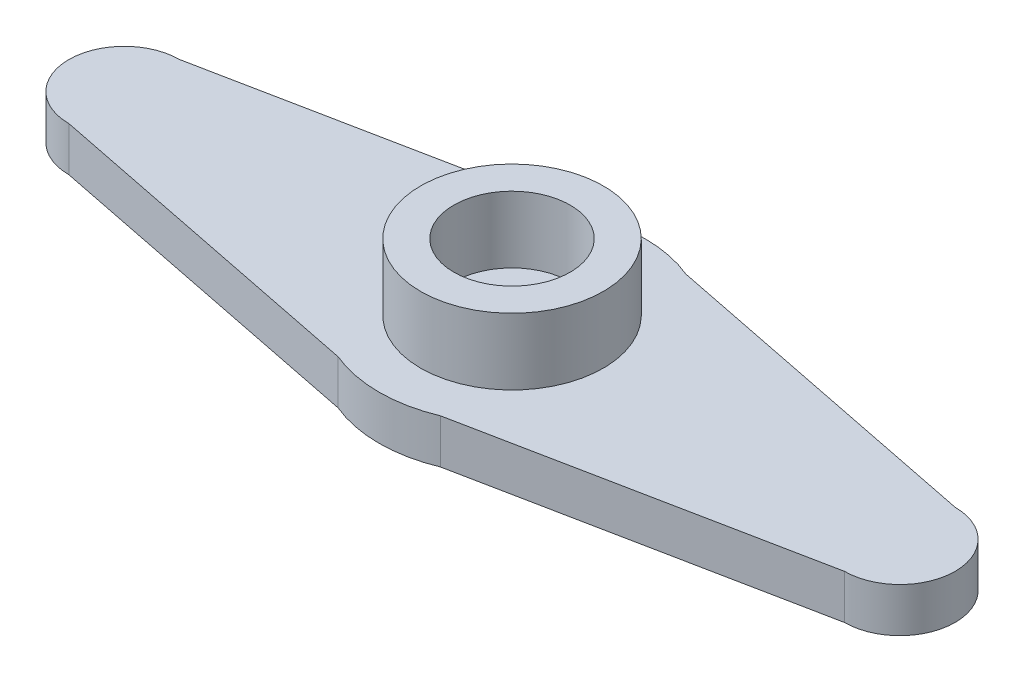
from build123d import *

# Parameters (mm, degrees)
BOSS_EXTRUDE1_DEPTH = 2
SKETCH2_R           = 4.125
SKETCH2_R_2         = 2.625
BOSS_EXTRUDE2_DEPTH = 3


with BuildPart() as part:
    # Sketch1 → Boss-Extrude1 (new body)
    with BuildSketch(Plane(origin=(0, 0, 0), x_dir=(1, 0, 0), z_dir=(0, 1, 0))):
        with BuildLine():
            Line((17.5, 2.5), (2.307692308, 5.538461538))
            ThreePointArc((2.307692308, 5.538461538), (0, 6), (-2.307692308, 5.538461538))
            Line((-2.307692308, 5.538461538), (-17.5, 2.5))
            ThreePointArc((-17.5, 2.5), (-20, 0), (-17.5, -2.5))
            Line((-17.5, -2.5), (-2.307692308, -5.538461538))
            ThreePointArc((-2.307692308, -5.538461538), (0, -6), (2.307692308, -5.538461538))
            Line((2.307692308, -5.538461538), (17.5, -2.5))
            ThreePointArc((17.5, -2.5), (20, 0), (17.5, 2.5))
        make_face()
    extrude(amount=BOSS_EXTRUDE1_DEPTH)

    # Sketch2 → Boss-Extrude2 (add)
    with BuildSketch(Plane(origin=(0, 2, 0), x_dir=(1, 0, 0), z_dir=(0, 1, 0))):
        with Locations(Location((0, 0, 0), (0, 0, 270))):
            Circle(SKETCH2_R)
        with Locations(Location((0, 0, 0), (0, 0, 270))):
            Circle(SKETCH2_R_2, mode=Mode.SUBTRACT)
    extrude(amount=BOSS_EXTRUDE2_DEPTH)


solid = part.part
